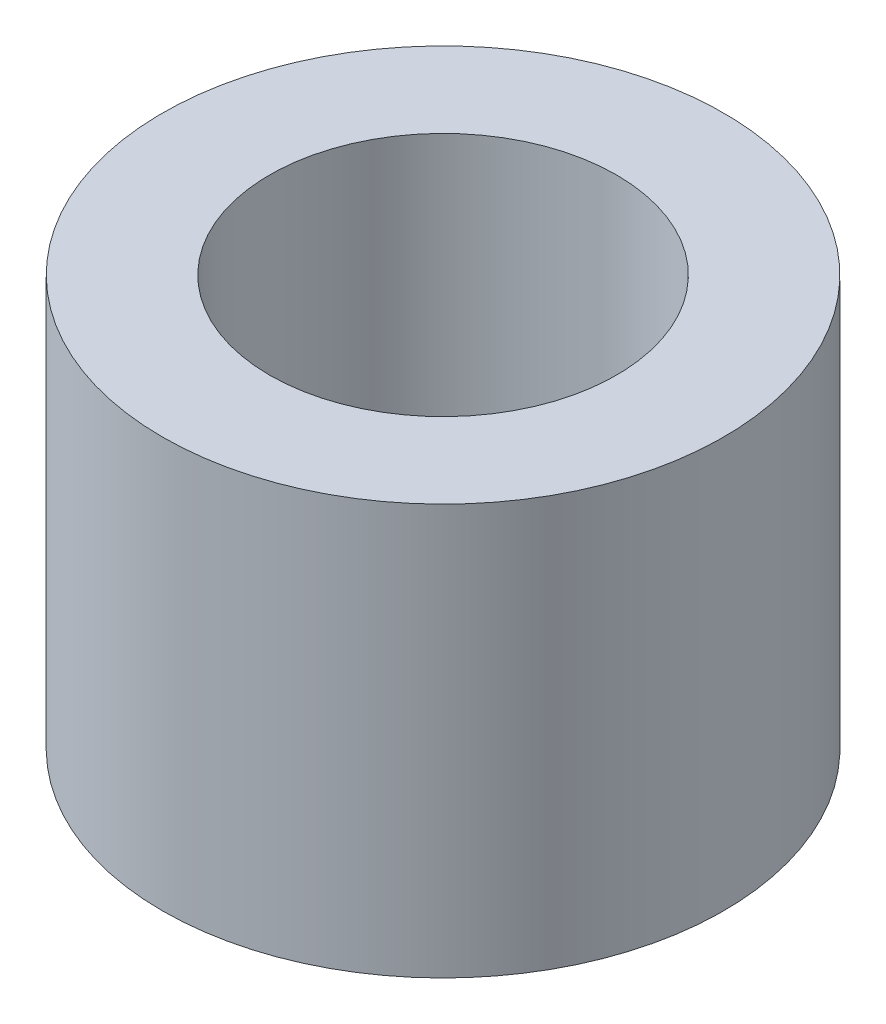
from build123d import *

# Parameters (mm, degrees)
SKETCH1_R           = 5.2375
SKETCH1_R_2         = 3.2375
BOSS_EXTRUDE1_DEPTH = 7.6596


with BuildPart() as part:
    # Sketch1 → Boss-Extrude1 (new body)
    with BuildSketch(Plane(origin=(0, 0, 0), x_dir=(1, 0, 0), z_dir=(0, 1, 0))):
        with Locations(Location((0, 0, 0), (0, 0, 270))):
            Circle(SKETCH1_R)
        with Locations(Location((0, 0, 0), (0, 0, 270))):
            Circle(SKETCH1_R_2, mode=Mode.SUBTRACT)
    extrude(amount=BOSS_EXTRUDE1_DEPTH)


solid = part.part
